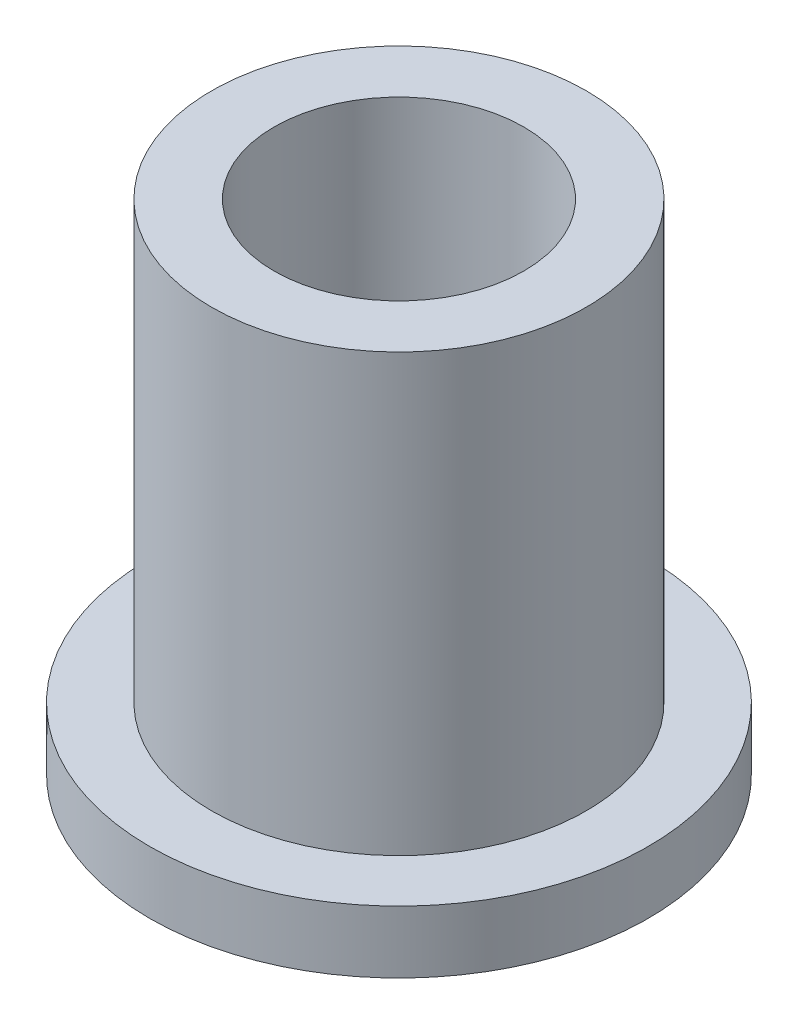
from build123d import *

# Parameters (mm, degrees)
SKETCH2_R           = 9.5504
SKETCH2_R_2         = 6.3627
BOSS_EXTRUDE1_DEPTH = 25.4
SKETCH3_R           = 12.7
SKETCH3_R_2         = 9.5504
BOSS_EXTRUDE2_DEPTH = 3.175


with BuildPart() as part:
    # Sketch2 → Boss-Extrude1 (new body)
    with BuildSketch(Plane(origin=(0, 0, 0), x_dir=(1, 0, 0), z_dir=(0, 1, 0))):
        with Locations(Location((0, 0, 0), (0, 0, 270))):
            Circle(SKETCH2_R)
        with Locations(Location((0, 0, 0), (0, 0, 270))):
            Circle(SKETCH2_R_2, mode=Mode.SUBTRACT)
    extrude(amount=BOSS_EXTRUDE1_DEPTH)

    # Sketch3 → Boss-Extrude2 (add)
    with BuildSketch(Plane(origin=(0, 0, 0), x_dir=(1, 0, 0), z_dir=(0, 1, 0))):
        with Locations(Location((0, 0, 0), (0, 0, 270))):
            Circle(SKETCH3_R)
        with Locations(Location((0, 0, 0), (0, 0, 270))):
            Circle(SKETCH3_R_2, mode=Mode.SUBTRACT)
    extrude(amount=BOSS_EXTRUDE2_DEPTH)


solid = part.part
